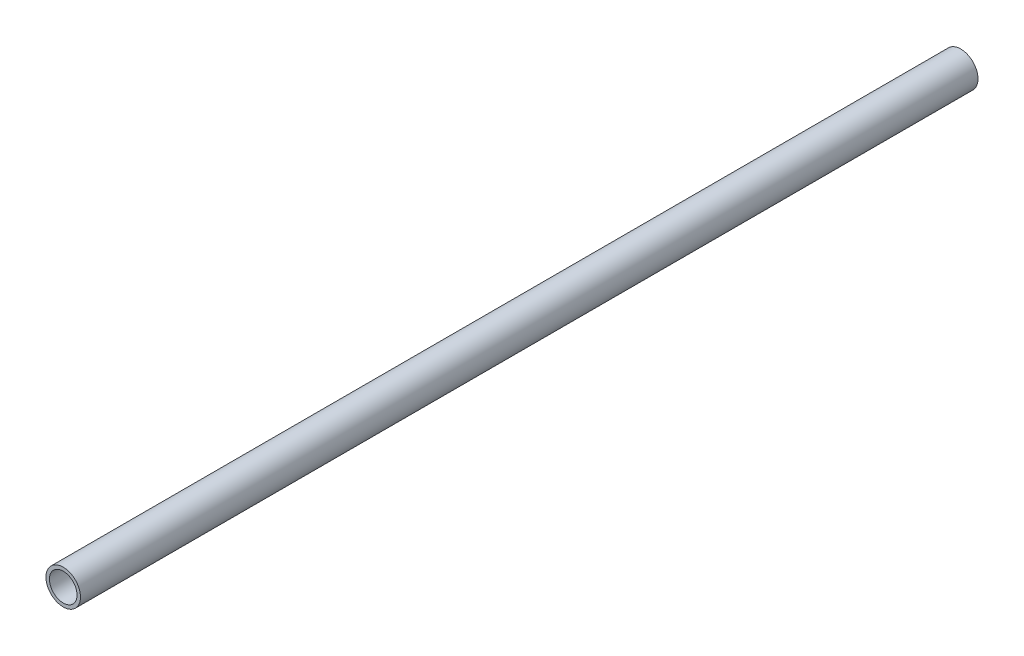
from build123d import *

# Parameters (mm, degrees)
ESQUISSE1_R        = 10
ESQUISSE1_R_2      = 8
BOSS_EXTRU_1_DEPTH = 520


with BuildPart() as part:
    # Esquisse1 → Boss.-Extru.1 (new body)
    with BuildSketch(Plane.XY):
        Circle(ESQUISSE1_R)
        Circle(ESQUISSE1_R_2, mode=Mode.SUBTRACT)
    extrude(amount=BOSS_EXTRU_1_DEPTH)


solid = part.part
